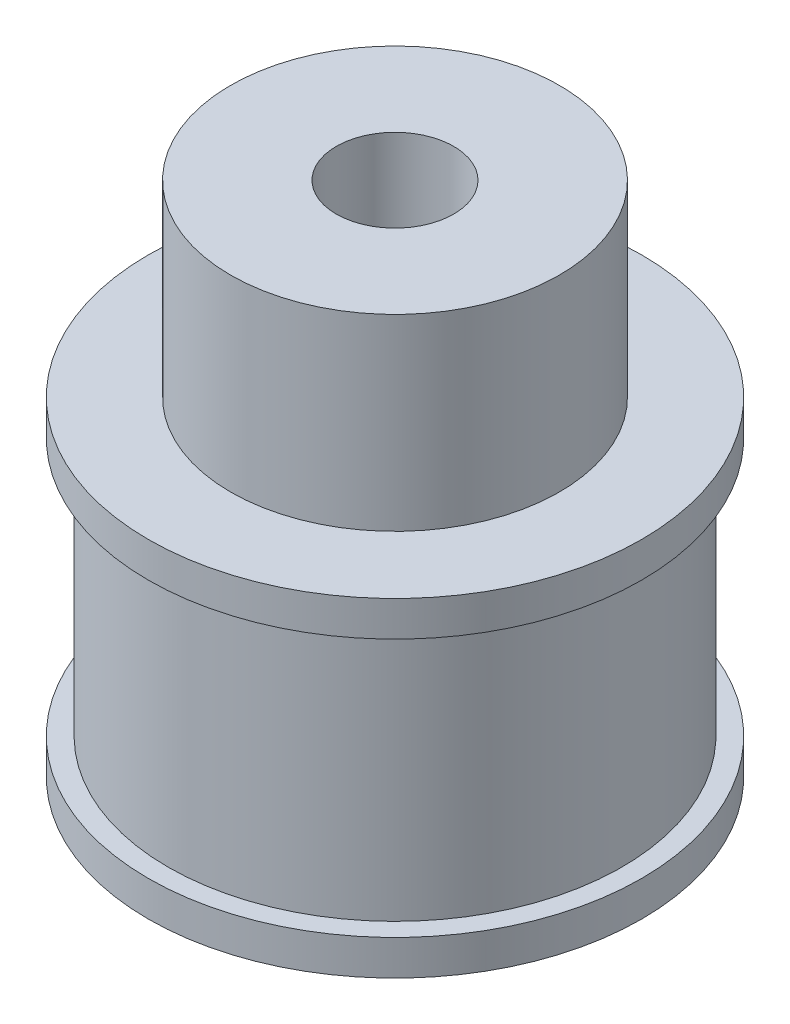
from build123d import *

# Parameters (mm, degrees)
SKETCH1_R           = 10.5
BOSS_EXTRUDE1_DEPTH = 14
SKETCH2_R           = 7
BOSS_EXTRUDE2_DEPTH = 8
SKETCH3_R           = 2.5
CUT_EXTRUDE1_DEPTH  = 27.54241888
CUT_EXTRUDE2_START  = 1.5
SKETCH4_OUTSIDE_W   = 30.392
SKETCH4_OUTSIDE_H   = 30.392
SKETCH4_OUTSIDE_R   = 9.6623253
CUT_EXTRUDE2_DEPTH  = 11


with BuildPart() as part:
    # Sketch1 → Boss-Extrude1 (new body)
    with BuildSketch(Plane(origin=(0, 0, 0), x_dir=(1, 0, 0), z_dir=(0, 1, 0))):
        with Locations(Location((0, 0, 0), (0, 0, 270))):
            Circle(SKETCH1_R)
    extrude(amount=BOSS_EXTRUDE1_DEPTH)

    # Sketch2 → Boss-Extrude2 (add)
    with BuildSketch(Plane(origin=(0, 14, 0), x_dir=(1, 0, 0), z_dir=(0, 1, 0))):
        with Locations(Location((0, 0, 0), (0, 0, 270))):
            Circle(SKETCH2_R)
    extrude(amount=BOSS_EXTRUDE2_DEPTH)

    # Sketch3 → Cut-Extrude1 (cut, through all)
    with BuildSketch(Plane(origin=(0, 22, 0), x_dir=(1, 0, 0), z_dir=(0, 1, 0))):
        with Locations(Location((0, 0, 0), (0, 0, 270))):
            Circle(SKETCH3_R)
    extrude(amount=-CUT_EXTRUDE1_DEPTH, mode=Mode.SUBTRACT)

    # Sketch4 outside → Cut-Extrude2 (cut)
    with BuildSketch(Plane(origin=(0, 0, 0), x_dir=(1, 0, 0), z_dir=(0, 1, 0)).offset(CUT_EXTRUDE2_START)):
        Rectangle(SKETCH4_OUTSIDE_W, SKETCH4_OUTSIDE_H)
        with Locations(Location((0, 0, 0), (0, 0, 270))):
            Circle(SKETCH4_OUTSIDE_R, mode=Mode.SUBTRACT)
    extrude(amount=CUT_EXTRUDE2_DEPTH, mode=Mode.SUBTRACT)


solid = part.part
